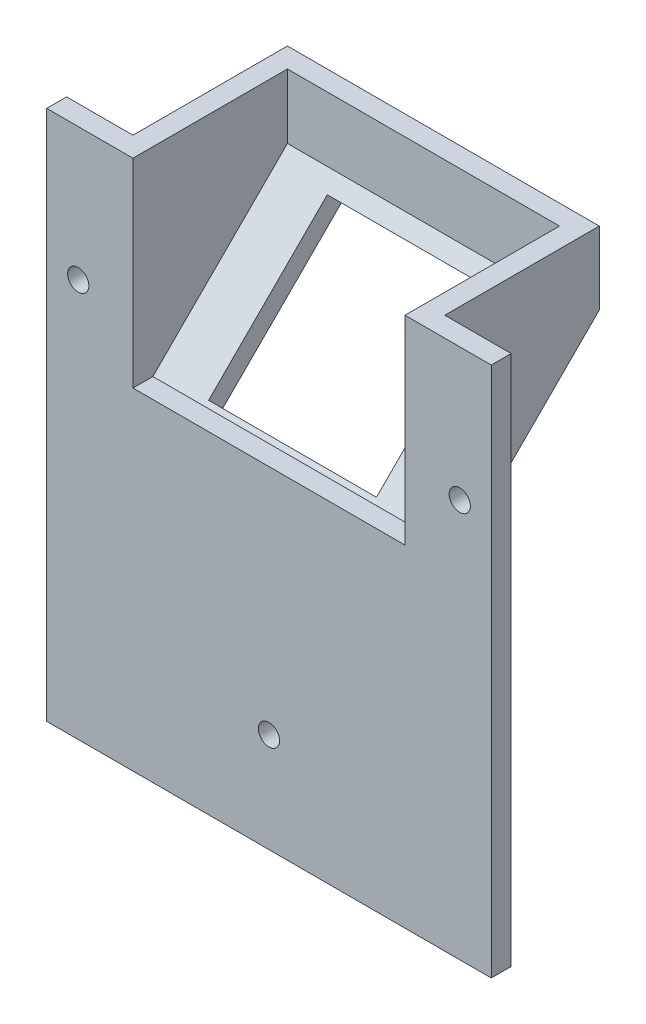
from build123d import *

# Parameters (mm, degrees)
Y_KSEKLIK_EKSTR_ZYON1_DEPTH = 3
Y_KSEKLIK_EKSTR_ZYON2_DEPTH = 3
Y_KSEKLIK_EKSTR_ZYON3_DEPTH = 3
Y_KSEKLIK_EKSTR_ZYON4_DEPTH = 41
M3_BO_LUKLU_DELIK1_D        = 3.2
M3_BO_LUKLU_DELIK1_DEPTH    = 10
M3_BO_LUKLU_DELIK1_TIP      = 0.96137699
IZIM10_W                    = 25.3
IZIM10_H                    = 25.3
KES_EKSTR_ZYON1_DEPTH       = 10


with BuildPart() as part:
    # Çizim1 → Yükseklik-Ekstrüzyon1 (new body)
    with BuildSketch(Plane.XY):
        Polygon((67, 0), (0, 0), (0, 80), (10, 80), (10, 50), (57, 50), (57, 80), (67, 80), align=None)
    extrude(amount=Y_KSEKLIK_EKSTR_ZYON1_DEPTH)

    # Çizim4 → Yükseklik-Ekstrüzyon3 (add)
    with BuildSketch(Plane.ZY.offset(-57)):
        Polygon((3, 80), (-23.280562552, 80), (-23.280562552, 69.037921865), (0, 45.757359313), (3, 45.757359313), align=None)
    extrude(amount=Y_KSEKLIK_EKSTR_ZYON3_DEPTH)



with BuildPart() as body_2:
    # Çizim2 → Yükseklik-Ekstrüzyon2 (new body)
    with BuildSketch(Plane(origin=(10, 0, 0), x_dir=(0, 0, -1), z_dir=(1, 0, 0))):
        Polygon((-3, 80), (23.280562552, 80), (23.280562552, 69.037921865), (0, 45.757359313), (-3, 45.757359313), align=None)
    extrude(amount=Y_KSEKLIK_EKSTR_ZYON2_DEPTH)


with BuildPart() as part_1:
    add(part.part)

    add(body_2.part)  # Yükseklik-Ekstrüzyon4 merges body 2
    # Çizim5 → Yükseklik-Ekstrüzyon4 (add)
    with BuildSketch(Plane.ZY.offset(-54)):
        Polygon((0, 45.757359313), (-23.280562552, 69.037921865), (-23.280562552, 80), (-20.280562552, 80), (-20.280562552, 70.280562552), (0, 50), align=None)
    extrude(amount=Y_KSEKLIK_EKSTR_ZYON4_DEPTH)

    # M3 Boşluklu Delik1
    with Locations(Plane.XY.offset(3)):
        with Locations((62.25, 60), (33.5, 15), (4.75, 60)):
            Hole(M3_BO_LUKLU_DELIK1_D / 2, depth=M3_BO_LUKLU_DELIK1_DEPTH)
            with Locations((0, 0, -(M3_BO_LUKLU_DELIK1_DEPTH + M3_BO_LUKLU_DELIK1_TIP / 2))):  # 118° drill point
                Cone(0, M3_BO_LUKLU_DELIK1_D / 2, M3_BO_LUKLU_DELIK1_TIP, mode=Mode.SUBTRACT)

    # Çizim10 → Kes-Ekstrüzyon1 (cut)
    with BuildSketch(Plane(origin=(0, 22.878679656, 22.878679656), x_dir=(1, 0, 0), z_dir=(0, -0.7071067811865438, -0.7071067811865513))):
        with Locations((33.5, -48.77902636)):
            Rectangle(IZIM10_W, IZIM10_H)
    extrude(amount=-KES_EKSTR_ZYON1_DEPTH, mode=Mode.SUBTRACT)


solid = part_1.part
